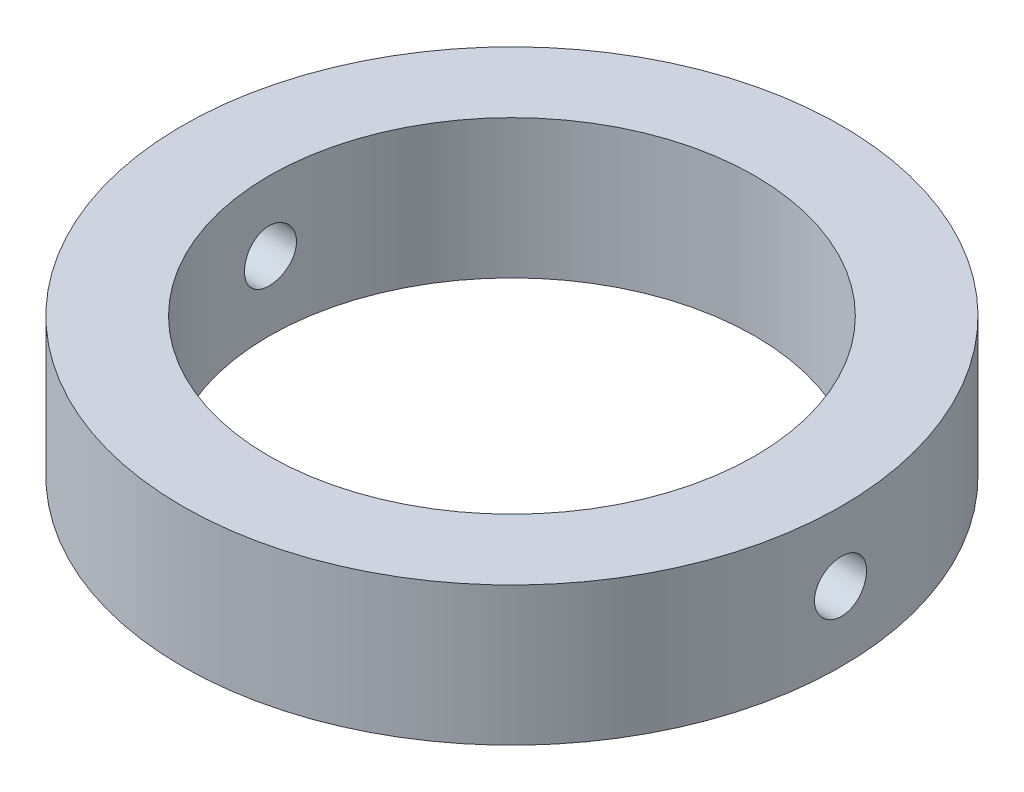
from build123d import *

# Parameters (mm, degrees)
SKETCH_1_R          = 38
SKETCH_1_R_2        = 28
EXTRUDE_1_DEPTH     = 16
SKETCH_2_R          = 3
CUT_EXTRUDE_1_DEPTH = 131


with BuildPart() as part:
    # Эскиз1 → Вытянуть1 (new body)
    with BuildSketch(Plane(origin=(0, 0, 0), x_dir=(1, 0, 0), z_dir=(0, 1, 0))):
        with Locations(Location((0, 0, 0), (0, 0, 270))):
            Circle(SKETCH_1_R)
        with Locations(Location((0, 0, 0), (0, 0, 270))):
            Circle(SKETCH_1_R_2, mode=Mode.SUBTRACT)
    extrude(amount=EXTRUDE_1_DEPTH)

    # Эскиз2 → Вырез-Вытянуть1 (cut, symmetric)
    with BuildSketch(Plane.ZY.offset(48)):
        with Locations((0, 8)):
            Circle(SKETCH_2_R)
    extrude(amount=CUT_EXTRUDE_1_DEPTH, both=True, mode=Mode.SUBTRACT)


solid = part.part
